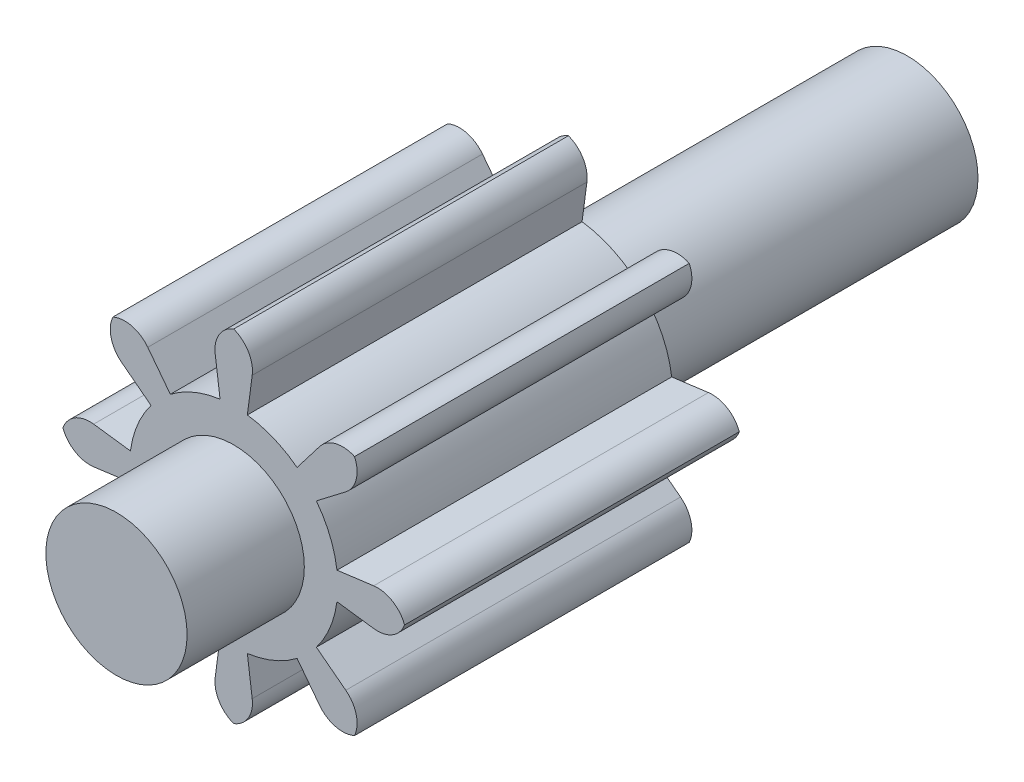
from build123d import *

# Parameters (mm, degrees)
SKETCH1_R                = 0.5
BOSS_EXTRUDE1_DEPTH      = 2.37
BOSS_EXTRUDE3_DEPTH      = 3.2
BOSS_EXTRUDE3_DEPTH_BACK = 2.4
SKETCH1_3_R              = 0.5


with BuildPart() as part:
    # Sketch1 → Boss-Extrude1 (new body)
    with BuildSketch(Plane.XY):
        with BuildLine():
            Line((-0.096588215, 0.731147705), (-0.130967072, 0.991386719))
            ThreePointArc((-0.130967072, 0.991386719), (-0.103602162, 1.123529505), (0, 1.21))
            ThreePointArc((0, 1.21), (0.103602162, 1.123529505), (0.130967072, 0.991386719))
            Line((0.130967072, 0.991386719), (0.096588215, 0.731147705))
            ThreePointArc((0.096588215, 0.731147705), (0.282229031, 0.681361155), (0.448701318, 0.585297682))
            Line((0.448701318, 0.585297682), (0.608408567, 0.793623976))
            ThreePointArc((0.608408567, 0.793623976), (0.721197541, 0.867713123), (0.855599205, 0.855599205))
            ThreePointArc((0.855599205, 0.855599205), (0.867713123, 0.721197541), (0.793623976, 0.608408567))
            Line((0.793623976, 0.608408567), (0.585297682, 0.448701318))
            ThreePointArc((0.585297682, 0.448701318), (0.681361155, 0.282229031), (0.731147705, 0.096588215))
            Line((0.731147705, 0.096588215), (0.991386719, 0.130967072))
            ThreePointArc((0.991386719, 0.130967072), (1.123529505, 0.103602162), (1.21, 0))
            ThreePointArc((1.21, 0), (1.123529505, -0.103602162), (0.991386719, -0.130967072))
            Line((0.991386719, -0.130967072), (0.731147705, -0.096588215))
            ThreePointArc((0.731147705, -0.096588215), (0.681361155, -0.282229031), (0.585297682, -0.448701318))
            Line((0.585297682, -0.448701318), (0.793623976, -0.608408567))
            ThreePointArc((0.793623976, -0.608408567), (0.867713123, -0.721197541), (0.855599205, -0.855599205))
            ThreePointArc((0.855599205, -0.855599205), (0.721197541, -0.867713123), (0.608408567, -0.793623976))
            Line((0.608408567, -0.793623976), (0.448701318, -0.585297682))
            ThreePointArc((0.448701318, -0.585297682), (0.282229031, -0.681361155), (0.096588215, -0.731147705))
            Line((0.096588215, -0.731147705), (0.130967072, -0.991386719))
            ThreePointArc((0.130967072, -0.991386719), (0.103602162, -1.123529505), (0, -1.21))
            ThreePointArc((0, -1.21), (-0.103602162, -1.123529505), (-0.130967072, -0.991386719))
            Line((-0.130967072, -0.991386719), (-0.096588215, -0.731147705))
            ThreePointArc((-0.096588215, -0.731147705), (-0.282229031, -0.681361155), (-0.448701318, -0.585297682))
            Line((-0.448701318, -0.585297682), (-0.608408567, -0.793623976))
            ThreePointArc((-0.608408567, -0.793623976), (-0.721197541, -0.867713123), (-0.855599205, -0.855599205))
            ThreePointArc((-0.855599205, -0.855599205), (-0.867713123, -0.721197541), (-0.793623976, -0.608408567))
            Line((-0.793623976, -0.608408567), (-0.585297682, -0.448701318))
            ThreePointArc((-0.585297682, -0.448701318), (-0.681361155, -0.282229031), (-0.731147705, -0.096588215))
            Line((-0.731147705, -0.096588215), (-0.991386719, -0.130967072))
            ThreePointArc((-0.991386719, -0.130967072), (-1.123529505, -0.103602162), (-1.21, 0))
            ThreePointArc((-1.21, 0), (-1.123529505, 0.103602162), (-0.991386719, 0.130967072))
            Line((-0.991386719, 0.130967072), (-0.731147705, 0.096588215))
            ThreePointArc((-0.731147705, 0.096588215), (-0.681361155, 0.282229031), (-0.585297682, 0.448701318))
            Line((-0.585297682, 0.448701318), (-0.793623976, 0.608408567))
            ThreePointArc((-0.793623976, 0.608408567), (-0.867713123, 0.721197541), (-0.855599205, 0.855599205))
            ThreePointArc((-0.855599205, 0.855599205), (-0.721197541, 0.867713123), (-0.608408567, 0.793623976))
            Line((-0.608408567, 0.793623976), (-0.448701318, 0.585297682))
            ThreePointArc((-0.448701318, 0.585297682), (-0.282229031, 0.681361155), (-0.096588215, 0.731147705))
        make_face()
        Circle(SKETCH1_R, mode=Mode.SUBTRACT)
    extrude(amount=BOSS_EXTRUDE1_DEPTH)

    # Sketch1<3> → Boss-Extrude3 (add, two sides: drawn at the far end of the back side and taken through both)
    with BuildSketch(Plane.XY.offset(-BOSS_EXTRUDE3_DEPTH_BACK)):
        Circle(SKETCH1_3_R)
    extrude(amount=BOSS_EXTRUDE3_DEPTH + BOSS_EXTRUDE3_DEPTH_BACK)


solid = part.part
